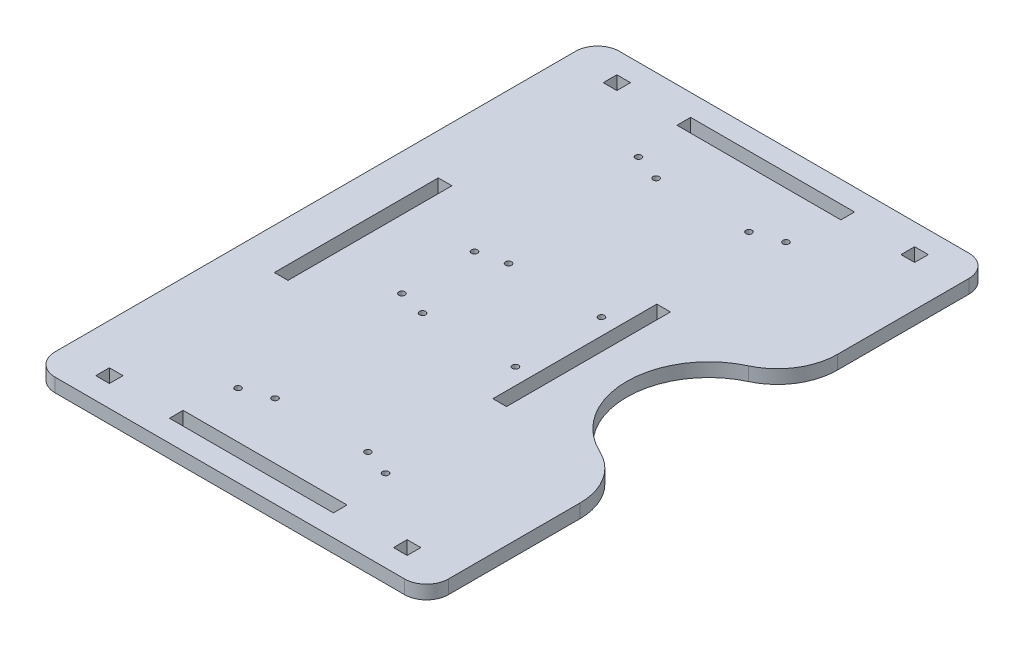
from build123d import *

# Parameters (mm, degrees)
SKETCH3_R           = 1.4224
SKETCH3_W           = 6.35
SKETCH3_H           = 6.35
SKETCH3_W_2         = 76.2
SKETCH3_H_2         = 76.2
BOSS_EXTRUDE1_DEPTH = 6.35
FILLET1_R           = 10.16
FILLET2_R           = 27.94


with BuildPart() as part:
    # Sketch3 → Boss-Extrude1 (new body)
    with BuildSketch(Plane(origin=(0, 0, 0), x_dir=(1, 0, 0), z_dir=(0, 1, 0))):
        with BuildLine():
            Line((182.88, 0), (0, 0))
            Line((0, 0), (0, 262.339276313))
            Line((0, 262.339276313), (182.88, 262.339276313))
            Line((182.88, 262.339276313), (182.88, 169.269638157))
            ThreePointArc((182.88, 169.269638157), (144.78, 131.169638157), (182.88, 93.069638157))
            Line((182.88, 93.069638157), (182.88, 0))
        make_face()
        with Locations(Location((57.15, 38.1, 0), (0, 0, 270))):
            Circle(SKETCH3_R, mode=Mode.SUBTRACT)
        with Locations(Location((57.15, 114.3, 0), (0, 0, 270))):
            Circle(SKETCH3_R, mode=Mode.SUBTRACT)
        with Locations(Location((125.73, 38.1, 0), (0, 0, 90))):
            Circle(SKETCH3_R, mode=Mode.SUBTRACT)
        with Locations(Location((69.85, 151.157668748, 0), (0, 0, 270))):
            Circle(SKETCH3_R, mode=Mode.SUBTRACT)
        with Locations(Location((69.85, 219.737668748, 0), (0, 0, 270))):
            Circle(SKETCH3_R, mode=Mode.SUBTRACT)
        with Locations(Location((113.03, 151.157668748, 0), (0, 0, 90))):
            Circle(SKETCH3_R, mode=Mode.SUBTRACT)
        with Locations(Location((113.03, 219.737668748, 0), (0, 0, 90))):
            Circle(SKETCH3_R, mode=Mode.SUBTRACT)
        with Locations(Location((113.03, 42.601607565, 0), (0, 0, 270))):
            Circle(SKETCH3_R, mode=Mode.SUBTRACT)
        with Locations(Location((113.03, 111.181607565, 0), (0, 0, 270))):
            Circle(SKETCH3_R, mode=Mode.SUBTRACT)
        with Locations(Location((69.85, 111.181607565, 0), (0, 0, 90))):
            Circle(SKETCH3_R, mode=Mode.SUBTRACT)
        with Locations(Location((69.85, 42.601607565, 0), (0, 0, 90))):
            Circle(SKETCH3_R, mode=Mode.SUBTRACT)
        with Locations(Location((125.73, 224.239276313, 0), (0, 0, 270))):
            Circle(SKETCH3_R, mode=Mode.SUBTRACT)
        with Locations(Location((57.15, 224.239276313, 0), (0, 0, 90))):
            Circle(SKETCH3_R, mode=Mode.SUBTRACT)
        with Locations(Location((57.15, 148.039276313, 0), (0, 0, 90))):
            Circle(SKETCH3_R, mode=Mode.SUBTRACT)
        with Locations((22.225, 13.212735966)):
            Rectangle(SKETCH3_W, SKETCH3_H, mode=Mode.SUBTRACT)
        with Locations((160.655, 13.212735966)):
            Rectangle(SKETCH3_W, SKETCH3_H, mode=Mode.SUBTRACT)
        with Locations((160.655, 249.126540348)):
            Rectangle(SKETCH3_W, SKETCH3_H, mode=Mode.SUBTRACT)
        with Locations((22.225, 249.126540348)):
            Rectangle(SKETCH3_W, SKETCH3_H, mode=Mode.SUBTRACT)
        with Locations((91.44, 249.126540348)):
            Rectangle(SKETCH3_W_2, SKETCH3_H, mode=Mode.SUBTRACT)
        with Locations((91.44, 13.212735966)):
            Rectangle(SKETCH3_W_2, SKETCH3_H, mode=Mode.SUBTRACT)
        with Locations((123.825, 131.169638157)):
            Rectangle(SKETCH3_W, SKETCH3_H_2, mode=Mode.SUBTRACT)
        with Locations((22.225, 131.169638157)):
            Rectangle(SKETCH3_W, SKETCH3_H_2, mode=Mode.SUBTRACT)
    extrude(amount=BOSS_EXTRUDE1_DEPTH)

    # Fillet1
    fillet1_edges = [part.edges().sort_by_distance(p)[0] for p in [
        (0, 3.175, -262.339276313),
        (182.88, 3.175, -262.339276313),
        (182.88, 3.175, 0),
        (0, 3.175, 0),
    ]]
    fillet(fillet1_edges, radius=FILLET1_R)

    # Fillet2
    fillet2_edges = [part.edges().sort_by_distance(p)[0] for p in [
        (182.88, 3.175, -169.269638157),
        (182.88, 3.175, -93.069638157),
    ]]
    fillet(fillet2_edges, radius=FILLET2_R)


solid = part.part
